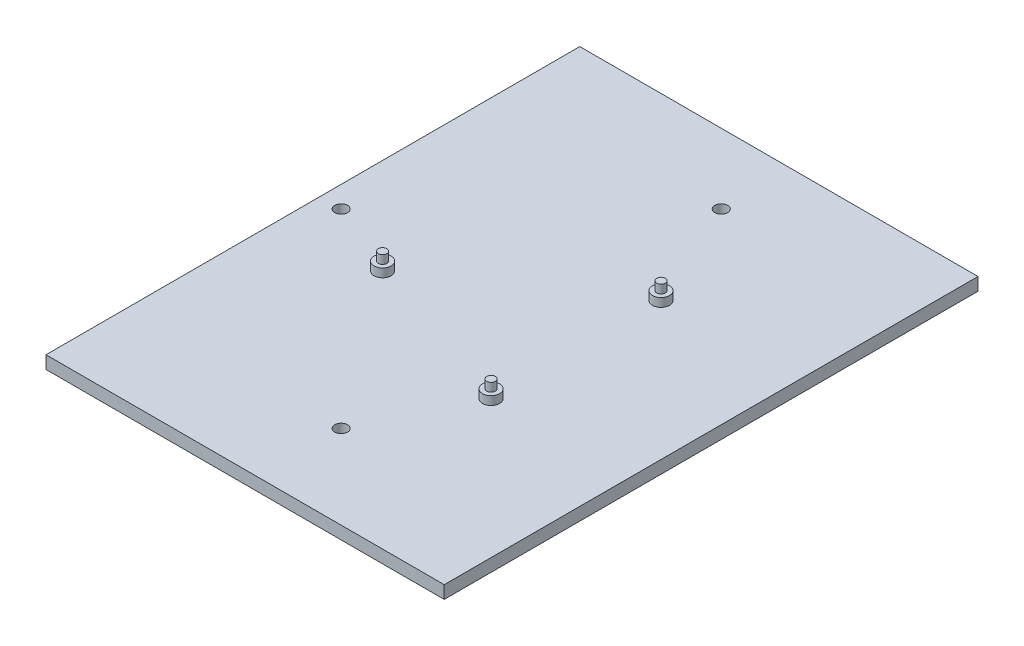
from build123d import *

# Parameters (mm, degrees)
SKETCH1_W           = 93.25
SKETCH1_H           = 125
BOSS_EXTRUDE1_DEPTH = 3
SKETCH3_R           = 1.5
CUT_EXTRUDE1_DEPTH  = 3
SKETCH4_R           = 2
SKETCH4_R_2         = 1
BOSS_EXTRUDE2_DEPTH = 2
SKETCH6_R           = 1
BOSS_EXTRUDE3_DEPTH = 4


with BuildPart() as part:
    # Sketch1 → Boss-Extrude1 (new body)
    with BuildSketch(Plane(origin=(0, 0, 0), x_dir=(1, 0, 0), z_dir=(0, 1, 0))):
        with Locations((-6.857134593, 56.824464746)):
            Rectangle(SKETCH1_W, SKETCH1_H)
    extrude(amount=BOSS_EXTRUDE1_DEPTH)

    # Sketch3 → Cut-Extrude1 (cut)
    with BuildSketch(Plane(origin=(0, 3, 0), x_dir=(1, 0, 0), z_dir=(0, 1, 0))):
        with Locations(Location((-3.982134593, 102.947941071, 0), (0, 0, 270))):
            Circle(SKETCH3_R)
    cut_extrude1 = extrude(amount=-CUT_EXTRUDE1_DEPTH, mode=Mode.SUBTRACT)

    # Sketch-Pattern1: Cut-Extrude1 at 2 more places
    with Locations((0, 0, 89), (-44.5, 0, 44.5)):
        add(cut_extrude1, mode=Mode.SUBTRACT)

    # Sketch4 → Boss-Extrude2 (add)
    with BuildSketch(Plane(origin=(0, 3, 0), x_dir=(1, 0, 0), z_dir=(0, 1, 0))):
        with Locations(Location((-31.082134593, 50.747941071, 0), (0, 0, 270))):
            Circle(SKETCH4_R)
        with Locations(Location((-31.082134593, 50.747941071, 0), (0, 0, 270))):
            Circle(SKETCH4_R_2, mode=Mode.SUBTRACT)
    boss_extrude2 = extrude(amount=BOSS_EXTRUDE2_DEPTH)

    # Sketch6 → Boss-Extrude3 (add)
    with BuildSketch(Plane(origin=(0, 3, 0), x_dir=(1, 0, 0), z_dir=(0, 1, 0))):
        with Locations(Location((-31.082134593, 50.747941071, 0), (0, 0, 270))):
            Circle(SKETCH6_R)
    boss_extrude3 = extrude(amount=BOSS_EXTRUDE3_DEPTH)

    # Sketch-Pattern2: Boss-Extrude2, Boss-Extrude3 at 2 more places
    with Locations((38.6, 0, -26.6), (38.6, 0, 13.2)):
        add(boss_extrude2)
        add(boss_extrude3)


solid = part.part
